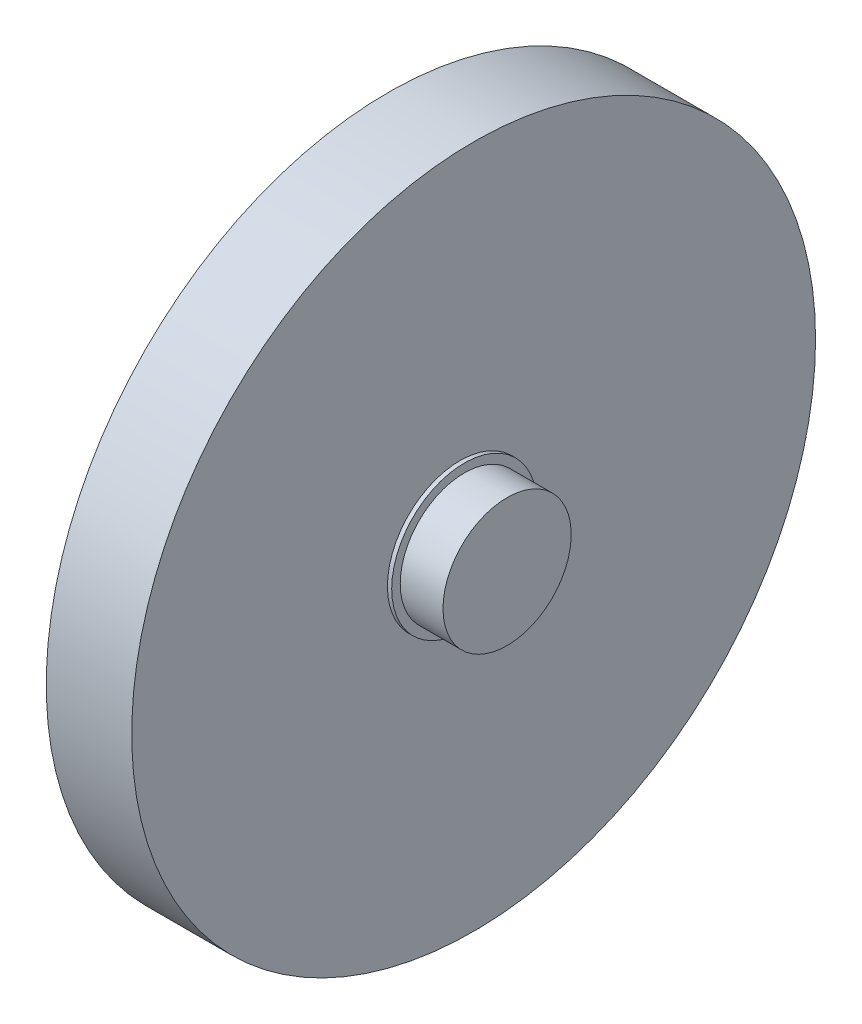
from build123d import *

# Parameters (mm, degrees)
SKETCH1_R           = 40
SKETCH1_R_2         = 3.175
BOSS_EXTRUDE1_DEPTH = 7
SKETCH2_R           = 40
SKETCH2_R_2         = 4
BOSS_EXTRUDE2_DEPTH = 2.5
SKETCH3_R           = 40
SKETCH3_R_2         = 4
SKETCH3_R_3         = 3.75
BOSS_EXTRUDE3_DEPTH = 0.5


with BuildPart() as part:
    # Sketch1 → Boss-Extrude1 (new body)
    # profile 1 of 11: a face of its own
    with BuildSketch(Plane(origin=(0, 0, 0), x_dir=(0, 0, -1), z_dir=(1, 0, 0))):
        with Locations((1.5875, 0)):
            Circle(SKETCH1_R)
        with BuildLine():
            ThreePointArc((-2.741552048, 30.148588945), (-0.829517102, 34.814722887), (3.175, 31.75))
            ThreePointArc((3.175, 31.75), (3.064722887, 30.920482898), (2.741552048, 30.148588945))
            ThreePointArc((2.741552048, 30.148588945), (10.792418529, 33.215648832), (15.502933761, 26.002164676))
            ThreePointArc((15.502933761, 26.002164676), (18.82031557, 28.857349126), (21.83718176, 25.686289571))
            ThreePointArc((21.83718176, 25.686289571), (21.320571551, 23.95032047), (19.938858158, 22.779276951))
            ThreePointArc((19.938858158, 22.779276951), (28.254918529, 20.528399936), (27.8258258, 11.923797281))
            ThreePointArc((27.8258258, 11.923797281), (31.326349875, 12.77828039), (33.371044392, 9.811289571))
            ThreePointArc((33.371044392, 9.811289571), (32.187879372, 7.338797223), (29.520198147, 6.7090554))
            ThreePointArc((29.520198147, 6.7090554), (34.925, 0), (29.520198147, -6.7090554))
            ThreePointArc((29.520198147, -6.7090554), (32.187879372, -7.338797223), (33.371044392, -9.811289571))
            ThreePointArc((33.371044392, -9.811289571), (31.326349875, -12.77828039), (27.8258258, -11.923797281))
            ThreePointArc((27.8258258, -11.923797281), (28.254918529, -20.528399936), (19.938858158, -22.779276951))
            ThreePointArc((19.938858158, -22.779276951), (21.320571551, -23.95032047), (21.83718176, -25.686289571))
            ThreePointArc((21.83718176, -25.686289571), (18.82031557, -28.857349126), (15.502933761, -26.002164676))
            ThreePointArc((15.502933761, -26.002164676), (10.792418529, -33.215648832), (2.741552048, -30.148588945))
            ThreePointArc((2.741552048, -30.148588945), (3.064722887, -30.920482898), (3.175, -31.75))
            ThreePointArc((3.175, -31.75), (-0.829517102, -34.814722887), (-2.741552048, -30.148588945))
            ThreePointArc((-2.741552048, -30.148588945), (-10.792418529, -33.215648832), (-15.502933761, -26.002164676))
            ThreePointArc((-15.502933761, -26.002164676), (-20.528399936, -28.254918529), (-19.938858158, -22.779276951))
            ThreePointArc((-19.938858158, -22.779276951), (-28.254918529, -20.528399936), (-27.8258258, -11.923797281))
            ThreePointArc((-27.8258258, -11.923797281), (-33.215648832, -10.792418529), (-29.520198147, -6.7090554))
            ThreePointArc((-29.520198147, -6.7090554), (-34.925, 0), (-29.520198147, 6.7090554))
            ThreePointArc((-29.520198147, 6.7090554), (-33.215648832, 10.792418529), (-27.8258258, 11.923797281))
            ThreePointArc((-27.8258258, 11.923797281), (-28.254918529, 20.528399936), (-19.938858158, 22.779276951))
            ThreePointArc((-19.938858158, 22.779276951), (-20.528399936, 28.254918529), (-15.502933761, 26.002164676))
            ThreePointArc((-15.502933761, 26.002164676), (-10.792418529, 33.215648832), (-2.741552048, 30.148588945))
        make_face(mode=Mode.SUBTRACT)
    # profile 2 of 11: a face of its own
    with BuildSketch(Plane(origin=(0, 0, 0), x_dir=(0, 0, -1), z_dir=(1, 0, 0))):
        with Locations((18.66218176, 25.686289571)):
            Circle(SKETCH1_R_2)
    # profile 3 of 11: a face of its own
    with BuildSketch(Plane(origin=(0, 0, 0), x_dir=(0, 0, -1), z_dir=(1, 0, 0))):
        with Locations((30.196044392, 9.811289571)):
            Circle(SKETCH1_R_2)
    # profile 4 of 11: a face of its own
    with BuildSketch(Plane(origin=(0, 0, 0), x_dir=(0, 0, -1), z_dir=(1, 0, 0))):
        with Locations((30.196044392, -9.811289571)):
            Circle(SKETCH1_R_2)
    # profile 5 of 11: a face of its own
    with BuildSketch(Plane(origin=(0, 0, 0), x_dir=(0, 0, -1), z_dir=(1, 0, 0))):
        with Locations((18.66218176, -25.686289571)):
            Circle(SKETCH1_R_2)
    # profile 6 of 11: a face of its own
    with BuildSketch(Plane(origin=(0, 0, 0), x_dir=(0, 0, -1), z_dir=(1, 0, 0))):
        with Locations((0, -31.75)):
            Circle(SKETCH1_R_2)
    # profile 7 of 11: a face of its own
    with BuildSketch(Plane(origin=(0, 0, 0), x_dir=(0, 0, -1), z_dir=(1, 0, 0))):
        with Locations((-18.66218176, -25.686289571)):
            Circle(SKETCH1_R_2)
    # profile 8 of 11: a face of its own
    with BuildSketch(Plane(origin=(0, 0, 0), x_dir=(0, 0, -1), z_dir=(1, 0, 0))):
        with Locations((-30.196044392, -9.811289571)):
            Circle(SKETCH1_R_2)
    # profile 9 of 11: a face of its own
    with BuildSketch(Plane(origin=(0, 0, 0), x_dir=(0, 0, -1), z_dir=(1, 0, 0))):
        with Locations((-30.196044392, 9.811289571)):
            Circle(SKETCH1_R_2)
    # profile 10 of 11: a face of its own
    with BuildSketch(Plane(origin=(0, 0, 0), x_dir=(0, 0, -1), z_dir=(1, 0, 0))):
        with Locations((-18.66218176, 25.686289571)):
            Circle(SKETCH1_R_2)
    # profile 11 of 11: a face of its own
    with BuildSketch(Plane(origin=(0, 0, 0), x_dir=(0, 0, -1), z_dir=(1, 0, 0))):
        with Locations((0, 31.75)):
            Circle(SKETCH1_R_2)
    extrude(amount=BOSS_EXTRUDE1_DEPTH)

    # Sketch2 → Boss-Extrude2 (add)
    with BuildSketch(Plane(origin=(7, 0, 0), x_dir=(0, 0, -1), z_dir=(1, 0, 0))):
        with Locations((1.5875, 0)):
            Circle(SKETCH2_R)
        Circle(SKETCH2_R_2, mode=Mode.SUBTRACT)
    extrude(amount=BOSS_EXTRUDE2_DEPTH)

    # Sketch3 → Boss-Extrude3 (add)
    # profile 1 of 2: a face of its own
    with BuildSketch(Plane(origin=(9.5, 0, 0), x_dir=(0, 0, -1), z_dir=(1, 0, 0))):
        with Locations((1.5875, 0)):
            Circle(SKETCH3_R)
        Circle(SKETCH3_R_2, mode=Mode.SUBTRACT)
    # profile 2 of 2: a face of its own
    with BuildSketch(Plane(origin=(9.5, 0, 0), x_dir=(0, 0, -1), z_dir=(1, 0, 0))):
        Circle(SKETCH3_R_2)
        Circle(SKETCH3_R_3, mode=Mode.SUBTRACT)
    extrude(amount=BOSS_EXTRUDE3_DEPTH)

    # Sketch4 → Revolve1 (revolve)
    with BuildSketch(Plane.XY, mode=Mode.PRIVATE) as revolve1_sk:
        Polygon((10, 8.5), (10.5, 8.5), (10.5, 7.5), (15.5, 7.5), (15.5, 0), (12.325, 0), (12.325, 3.75), (10, 3.75), align=None)
    revolve(revolve1_sk.sketch.rotate(Axis((12.325, 0, 0), (1, 0, 0)), 90), axis=Axis((12.325, 0, 0), (1, 0, 0)))


solid = part.part
